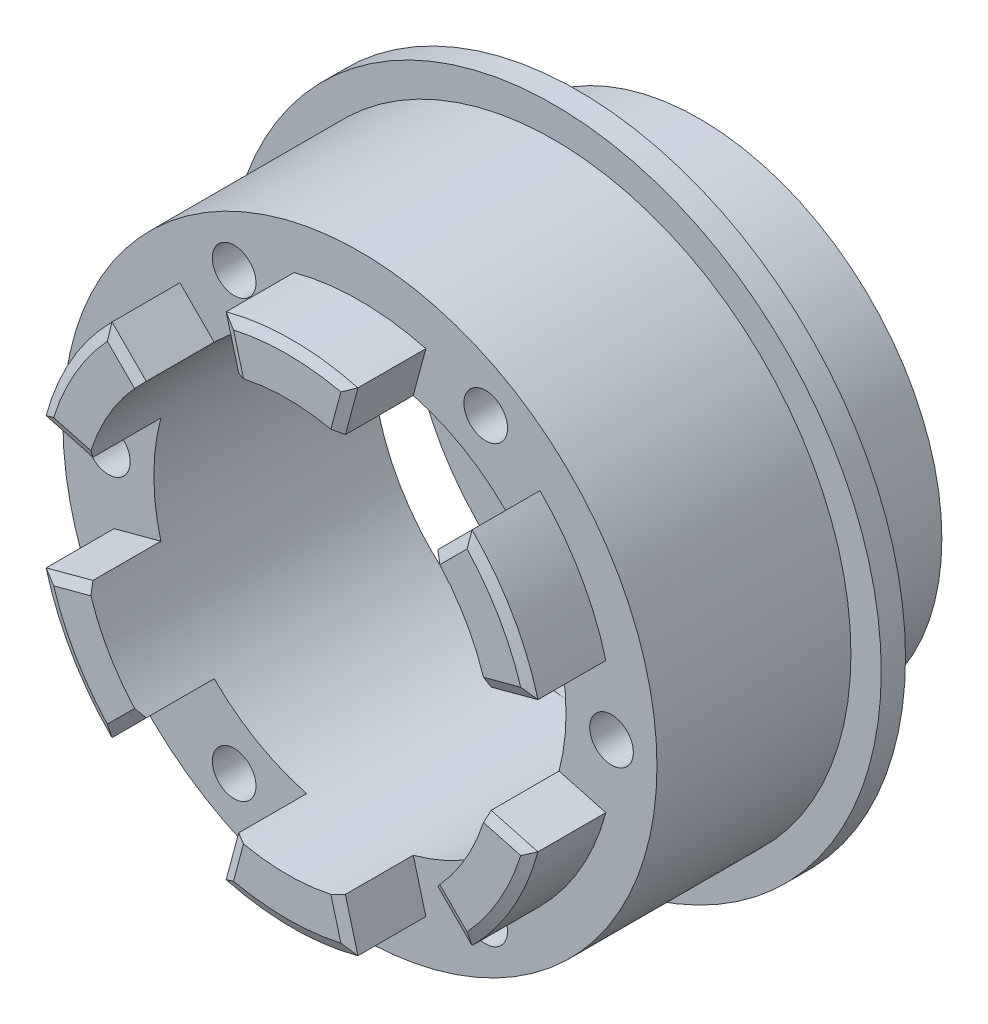
from build123d import *
from OCP.BRepFilletAPI import BRepFilletAPI_MakeChamfer

# Parameters (mm, degrees)
SKETCH_1_R          = 10
EXTRUDE_1_DEPTH     = 2
SKETCH_2_R          = 10
SKETCH_2_R_2        = 8.5
EXTRUDE_2_DEPTH     = 3
SKETCH_4_R          = 13.5
SKETCH_4_R_2        = 8.5
EXTRUDE_3_DEPTH     = 1
SKETCH_5_R          = 12.25
SKETCH_5_R_2        = 8.5
EXTRUDE_4_DEPTH     = 8
SKETCH_6_R          = 0.9
CUT_EXTRUDE_1_DEPTH = 8
SKETCH_7_R          = 3
SKETCH_7_R_2        = 1.15
CUT_EXTRUDE_2_DEPTH = 24.674881204
SKETCH_9_W          = 3
SKETCH_9_H          = 17
CUT_EXTRUDE_4_DEPTH = 24.674881204
EXTRUDE_5_DEPTH     = 3
CHAMFER_1_SIZE      = 0.2
CHAMFER_1_SIZE2     = 0.410060768


with BuildPart() as part:
    # 스케치1 → 보스-돌출1 (new body)
    with BuildSketch(Plane.XY):
        Circle(SKETCH_1_R)
    extrude(amount=EXTRUDE_1_DEPTH)

    # 스케치2 → 보스-돌출2 (add)
    with BuildSketch(Plane.XY.offset(2)):
        Circle(SKETCH_2_R)
        Circle(SKETCH_2_R_2, mode=Mode.SUBTRACT)
    extrude(amount=EXTRUDE_2_DEPTH)

    # 스케치4 → 보스-돌출3 (add)
    with BuildSketch(Plane.XY.offset(5)):
        Circle(SKETCH_4_R)
        Circle(SKETCH_4_R_2, mode=Mode.SUBTRACT)
    extrude(amount=EXTRUDE_3_DEPTH)

    # 스케치5 → 보스-돌출4 (add)
    with BuildSketch(Plane.XY.offset(6)):
        Circle(SKETCH_5_R)
        Circle(SKETCH_5_R_2, mode=Mode.SUBTRACT)
    extrude(amount=EXTRUDE_4_DEPTH)

    # 스케치6 → 컷-돌출1 (cut)
    with BuildSketch(Plane.XY.offset(14)):
        with Locations((10.375, 0)):
            Circle(SKETCH_6_R)
        with Locations((5.1875, -8.985013564)):
            Circle(SKETCH_6_R)
        with Locations((-5.1875, -8.985013564)):
            Circle(SKETCH_6_R)
        with Locations((-10.375, 0)):
            Circle(SKETCH_6_R)
        with Locations((-5.1875, 8.985013564)):
            Circle(SKETCH_6_R)
        with Locations((5.1875, 8.985013564)):
            Circle(SKETCH_6_R)
    extrude(amount=-CUT_EXTRUDE_1_DEPTH, mode=Mode.SUBTRACT)

    # 스케치7 → 컷-돌출2 (cut, through all)
    with BuildSketch(Plane(origin=(0, 0, 0), x_dir=(-1, 0, 0), z_dir=(0, 0, -1))):
        Circle(SKETCH_7_R)
        with Locations((-7, 0)):
            Circle(SKETCH_7_R_2)
        with Locations((7, 0)):
            Circle(SKETCH_7_R_2)
        with Locations((0, 7)):
            Circle(SKETCH_7_R_2)
        with Locations((0, -7)):
            Circle(SKETCH_7_R_2)
    extrude(amount=-CUT_EXTRUDE_2_DEPTH, mode=Mode.SUBTRACT)

    # 스케치9 → 컷-돌출4 (cut, through all)
    with BuildSketch(Plane(origin=(0, 0, 0), x_dir=(0, 0, -1), z_dir=(1, 0, 0))):
        with Locations((-3.5, 0)):
            Rectangle(SKETCH_9_W, SKETCH_9_H)
    extrude(amount=-CUT_EXTRUDE_4_DEPTH, mode=Mode.SUBTRACT)

    # 스케치10 → 보스-돌출5 (add)
    with BuildSketch(Plane.XY.offset(14)):
        with BuildLine():
            Line((2.199961883, 8.210369523), (2.717599974, 10.142221176))
            ThreePointArc((2.717599974, 10.142221176), (0, 10.5), (-2.717599974, 10.142221176))
            Line((-2.717599974, 10.142221176), (-2.199961883, 8.210369523))
            ThreePointArc((-2.199961883, 8.210369523), (0, 8.5), (2.199961883, 8.210369523))
        make_face()
        with BuildLine():
            Line((6.01040764, 6.01040764), (7.424621202, 7.424621202))
            ThreePointArc((7.424621202, 7.424621202), (9.09326674, 5.25), (10.142221176, 2.717599974))
            Line((10.142221176, 2.717599974), (8.210369523, 2.199961883))
            ThreePointArc((8.210369523, 2.199961883), (7.361215932, 4.25), (6.01040764, 6.01040764))
        make_face()
        with BuildLine():
            Line((8.210369523, -2.199961883), (10.142221176, -2.717599974))
            ThreePointArc((10.142221176, -2.717599974), (9.09326674, -5.25), (7.424621202, -7.424621202))
            Line((7.424621202, -7.424621202), (6.01040764, -6.01040764))
            ThreePointArc((6.01040764, -6.01040764), (7.361215932, -4.25), (8.210369523, -2.199961883))
        make_face()
        with BuildLine():
            Line((2.199961883, -8.210369523), (2.717599974, -10.142221176))
            ThreePointArc((2.717599974, -10.142221176), (0, -10.5), (-2.717599974, -10.142221176))
            Line((-2.717599974, -10.142221176), (-2.199961883, -8.210369523))
            ThreePointArc((-2.199961883, -8.210369523), (0, -8.5), (2.199961883, -8.210369523))
        make_face()
        with BuildLine():
            Line((-6.01040764, -6.01040764), (-7.424621202, -7.424621202))
            ThreePointArc((-7.424621202, -7.424621202), (-9.09326674, -5.25), (-10.142221176, -2.717599974))
            Line((-10.142221176, -2.717599974), (-8.210369523, -2.199961883))
            ThreePointArc((-8.210369523, -2.199961883), (-7.361215932, -4.25), (-6.01040764, -6.01040764))
        make_face()
        with BuildLine():
            Line((-8.210369523, 2.199961883), (-10.142221176, 2.717599974))
            ThreePointArc((-10.142221176, 2.717599974), (-9.09326674, 5.25), (-7.424621202, 7.424621202))
            Line((-7.424621202, 7.424621202), (-6.01040764, 6.01040764))
            ThreePointArc((-6.01040764, 6.01040764), (-7.361215932, 4.25), (-8.210369523, 2.199961883))
        make_face()
    extrude(amount=EXTRUDE_5_DEPTH)

    # 모따기1: one chamfer whose edges measure the first distance from different faces: ONE call of the kernel's chamfer builder (chamfer() names one face for all edges)
    chamfer_1_edges_1 = [part.edges().sort_by_distance(p)[0] for p in [
        (-6.717514421, 6.717514421, 17),
    ]]
    chamfer_1_side_1 = [part.faces().sort_by_distance(p)[0] for p in [
        (-6.717514421, 6.717514421, 15.5),
    ]]
    chamfer_1_edges_2 = [part.edges().sort_by_distance(p)[0] for p in [
        (-9.09326674, 5.25, 17),
    ]]
    chamfer_1_side_2 = [part.faces().sort_by_distance(p)[0] for p in [
        (-9.09326674, 5.25, 15.5),
    ]]
    chamfer_1_edges_3 = [part.edges().sort_by_distance(p)[0] for p in [
        (-9.17629535, 2.458780928, 17),
    ]]
    chamfer_1_side_3 = [part.faces().sort_by_distance(p)[0] for p in [
        (-9.17629535, 2.458780928, 15.5),
    ]]
    chamfer_1_edges_4 = [part.edges().sort_by_distance(p)[0] for p in [
        (-9.17629535, -2.458780928, 17),
    ]]
    chamfer_1_side_4 = [part.faces().sort_by_distance(p)[0] for p in [
        (-9.17629535, -2.458780928, 15.5),
    ]]
    chamfer_1_edges_5 = [part.edges().sort_by_distance(p)[0] for p in [
        (-9.09326674, -5.25, 17),
    ]]
    chamfer_1_side_5 = [part.faces().sort_by_distance(p)[0] for p in [
        (-9.09326674, -5.25, 15.5),
    ]]
    chamfer_1_edges_6 = [part.edges().sort_by_distance(p)[0] for p in [
        (-6.717514421, -6.717514421, 17),
    ]]
    chamfer_1_side_6 = [part.faces().sort_by_distance(p)[0] for p in [
        (-6.717514421, -6.717514421, 15.5),
    ]]
    chamfer_1_edges_7 = [part.edges().sort_by_distance(p)[0] for p in [
        (0, 10.5, 17),
    ]]
    chamfer_1_side_7 = [part.faces().sort_by_distance(p)[0] for p in [
        (0, 10.5, 15.5),
    ]]
    chamfer_1_edges_8 = [part.edges().sort_by_distance(p)[0] for p in [
        (-2.458780928, 9.17629535, 17),
    ]]
    chamfer_1_side_8 = [part.faces().sort_by_distance(p)[0] for p in [
        (-2.458780928, 9.17629535, 15.5),
    ]]
    chamfer_1_edges_9 = [part.edges().sort_by_distance(p)[0] for p in [
        (2.458780928, 9.17629535, 17),
    ]]
    chamfer_1_side_9 = [part.faces().sort_by_distance(p)[0] for p in [
        (2.458780928, 9.17629535, 15.5),
    ]]
    chamfer_1_edges_10 = [part.edges().sort_by_distance(p)[0] for p in [
        (-2.458780928, -9.17629535, 17),
    ]]
    chamfer_1_side_10 = [part.faces().sort_by_distance(p)[0] for p in [
        (-2.458780928, -9.17629535, 15.5),
    ]]
    chamfer_1_edges_11 = [part.edges().sort_by_distance(p)[0] for p in [
        (0, -10.5, 17),
    ]]
    chamfer_1_side_11 = [part.faces().sort_by_distance(p)[0] for p in [
        (0, -10.5, 15.5),
    ]]
    chamfer_1_edges_12 = [part.edges().sort_by_distance(p)[0] for p in [
        (2.458780928, -9.17629535, 17),
    ]]
    chamfer_1_side_12 = [part.faces().sort_by_distance(p)[0] for p in [
        (2.458780928, -9.17629535, 15.5),
    ]]
    chamfer_1_edges_13 = [part.edges().sort_by_distance(p)[0] for p in [
        (9.09326674, 5.25, 17),
    ]]
    chamfer_1_side_13 = [part.faces().sort_by_distance(p)[0] for p in [
        (9.09326674, 5.25, 15.5),
    ]]
    chamfer_1_edges_14 = [part.edges().sort_by_distance(p)[0] for p in [
        (6.717514421, 6.717514421, 17),
    ]]
    chamfer_1_side_14 = [part.faces().sort_by_distance(p)[0] for p in [
        (6.717514421, 6.717514421, 15.5),
    ]]
    chamfer_1_edges_15 = [part.edges().sort_by_distance(p)[0] for p in [
        (9.17629535, 2.458780928, 17),
    ]]
    chamfer_1_side_15 = [part.faces().sort_by_distance(p)[0] for p in [
        (9.17629535, 2.458780928, 15.5),
    ]]
    chamfer_1_edges_16 = [part.edges().sort_by_distance(p)[0] for p in [
        (6.717514421, -6.717514421, 17),
    ]]
    chamfer_1_side_16 = [part.faces().sort_by_distance(p)[0] for p in [
        (6.717514421, -6.717514421, 15.5),
    ]]
    chamfer_1_edges_17 = [part.edges().sort_by_distance(p)[0] for p in [
        (9.09326674, -5.25, 17),
    ]]
    chamfer_1_side_17 = [part.faces().sort_by_distance(p)[0] for p in [
        (9.09326674, -5.25, 15.5),
    ]]
    chamfer_1_edges_18 = [part.edges().sort_by_distance(p)[0] for p in [
        (9.17629535, -2.458780928, 17),
    ]]
    chamfer_1_side_18 = [part.faces().sort_by_distance(p)[0] for p in [
        (9.17629535, -2.458780928, 15.5),
    ]]
    chamfer_1 = BRepFilletAPI_MakeChamfer(part.part.solid().wrapped)
    for e in chamfer_1_edges_1:
        chamfer_1.Add(CHAMFER_1_SIZE, CHAMFER_1_SIZE2, e.wrapped, chamfer_1_side_1[0].wrapped)  # the first distance lies on this face
    for e in chamfer_1_edges_2:
        chamfer_1.Add(CHAMFER_1_SIZE, CHAMFER_1_SIZE2, e.wrapped, chamfer_1_side_2[0].wrapped)  # the first distance lies on this face
    for e in chamfer_1_edges_3:
        chamfer_1.Add(CHAMFER_1_SIZE, CHAMFER_1_SIZE2, e.wrapped, chamfer_1_side_3[0].wrapped)  # the first distance lies on this face
    for e in chamfer_1_edges_4:
        chamfer_1.Add(CHAMFER_1_SIZE, CHAMFER_1_SIZE2, e.wrapped, chamfer_1_side_4[0].wrapped)  # the first distance lies on this face
    for e in chamfer_1_edges_5:
        chamfer_1.Add(CHAMFER_1_SIZE, CHAMFER_1_SIZE2, e.wrapped, chamfer_1_side_5[0].wrapped)  # the first distance lies on this face
    for e in chamfer_1_edges_6:
        chamfer_1.Add(CHAMFER_1_SIZE, CHAMFER_1_SIZE2, e.wrapped, chamfer_1_side_6[0].wrapped)  # the first distance lies on this face
    for e in chamfer_1_edges_7:
        chamfer_1.Add(CHAMFER_1_SIZE, CHAMFER_1_SIZE2, e.wrapped, chamfer_1_side_7[0].wrapped)  # the first distance lies on this face
    for e in chamfer_1_edges_8:
        chamfer_1.Add(CHAMFER_1_SIZE, CHAMFER_1_SIZE2, e.wrapped, chamfer_1_side_8[0].wrapped)  # the first distance lies on this face
    for e in chamfer_1_edges_9:
        chamfer_1.Add(CHAMFER_1_SIZE, CHAMFER_1_SIZE2, e.wrapped, chamfer_1_side_9[0].wrapped)  # the first distance lies on this face
    for e in chamfer_1_edges_10:
        chamfer_1.Add(CHAMFER_1_SIZE, CHAMFER_1_SIZE2, e.wrapped, chamfer_1_side_10[0].wrapped)  # the first distance lies on this face
    for e in chamfer_1_edges_11:
        chamfer_1.Add(CHAMFER_1_SIZE, CHAMFER_1_SIZE2, e.wrapped, chamfer_1_side_11[0].wrapped)  # the first distance lies on this face
    for e in chamfer_1_edges_12:
        chamfer_1.Add(CHAMFER_1_SIZE, CHAMFER_1_SIZE2, e.wrapped, chamfer_1_side_12[0].wrapped)  # the first distance lies on this face
    for e in chamfer_1_edges_13:
        chamfer_1.Add(CHAMFER_1_SIZE, CHAMFER_1_SIZE2, e.wrapped, chamfer_1_side_13[0].wrapped)  # the first distance lies on this face
    for e in chamfer_1_edges_14:
        chamfer_1.Add(CHAMFER_1_SIZE, CHAMFER_1_SIZE2, e.wrapped, chamfer_1_side_14[0].wrapped)  # the first distance lies on this face
    for e in chamfer_1_edges_15:
        chamfer_1.Add(CHAMFER_1_SIZE, CHAMFER_1_SIZE2, e.wrapped, chamfer_1_side_15[0].wrapped)  # the first distance lies on this face
    for e in chamfer_1_edges_16:
        chamfer_1.Add(CHAMFER_1_SIZE, CHAMFER_1_SIZE2, e.wrapped, chamfer_1_side_16[0].wrapped)  # the first distance lies on this face
    for e in chamfer_1_edges_17:
        chamfer_1.Add(CHAMFER_1_SIZE, CHAMFER_1_SIZE2, e.wrapped, chamfer_1_side_17[0].wrapped)  # the first distance lies on this face
    for e in chamfer_1_edges_18:
        chamfer_1.Add(CHAMFER_1_SIZE, CHAMFER_1_SIZE2, e.wrapped, chamfer_1_side_18[0].wrapped)  # the first distance lies on this face
    add(Compound.cast(chamfer_1.Shape()), mode=Mode.REPLACE)


solid = part.part
